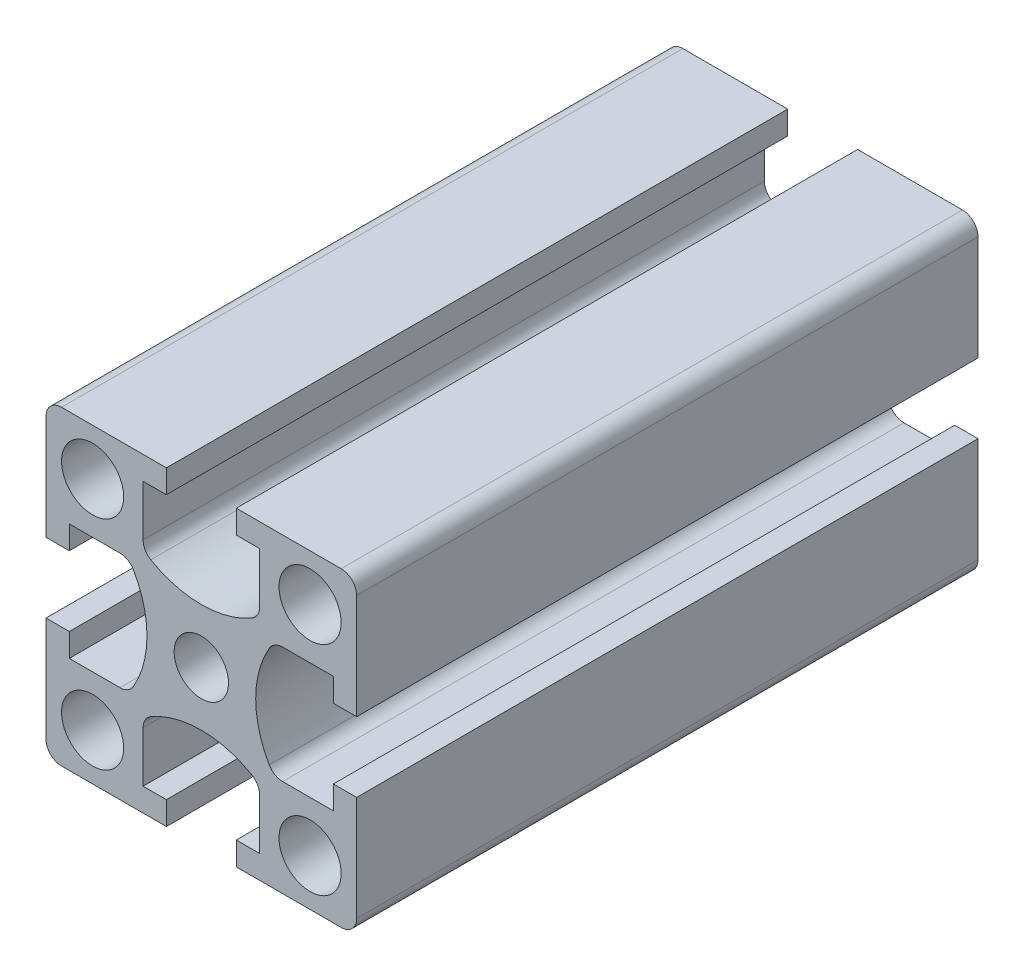
from build123d import *

# Parameters (mm, degrees)
SKETCH1_R           = 5
SKETCH1_R_2         = 4.375
BOSS_EXTRUDE1_DEPTH = 100


with BuildPart() as part:
    # Sketch1 → Boss-Extrude1 (new body)
    with BuildSketch(Plane.XY):
        with BuildLine():
            Line((-25, 22.5), (-25, 5.625))
            Line((-25, 5.625), (-21.25, 5.625))
            Line((-21.25, 5.625), (-21.25, 9.375))
            Line((-21.25, 9.375), (-13.092150698, 9.375))
            ThreePointArc((-13.092150698, 9.375), (-11.842150698, 9.040063509), (-10.927087189, 8.125))
            ThreePointArc((-10.927087189, 8.125), (-8.75, 0), (-10.927087189, -8.125))
            ThreePointArc((-10.927087189, -8.125), (-11.842150698, -9.040063509), (-13.092150698, -9.375))
            Line((-13.092150698, -9.375), (-21.25, -9.375))
            Line((-21.25, -9.375), (-21.25, -5.625))
            Line((-21.25, -5.625), (-25, -5.625))
            Line((-25, -5.625), (-25, -22.5))
            ThreePointArc((-25, -22.5), (-24.267766953, -24.267766953), (-22.5, -25))
            Line((-22.5, -25), (-5.625, -25))
            Line((-5.625, -25), (-5.625, -21.25))
            Line((-5.625, -21.25), (-9.375, -21.25))
            Line((-9.375, -21.25), (-9.375, -13.092150698))
            ThreePointArc((-9.375, -13.092150698), (-9.040063509, -11.842150698), (-8.125, -10.927087189))
            ThreePointArc((-8.125, -10.927087189), (0, -8.75), (8.125, -10.927087189))
            ThreePointArc((8.125, -10.927087189), (9.040063509, -11.842150698), (9.375, -13.092150698))
            Line((9.375, -13.092150698), (9.375, -21.25))
            Line((9.375, -21.25), (5.625, -21.25))
            Line((5.625, -21.25), (5.625, -25))
            Line((5.625, -25), (22.5, -25))
            ThreePointArc((22.5, -25), (24.267766953, -24.267766953), (25, -22.5))
            Line((25, -22.5), (25, -5.625))
            Line((25, -5.625), (21.25, -5.625))
            Line((21.25, -5.625), (21.25, -9.375))
            Line((21.25, -9.375), (13.092150698, -9.375))
            ThreePointArc((13.092150698, -9.375), (11.842150698, -9.040063509), (10.927087189, -8.125))
            ThreePointArc((10.927087189, -8.125), (8.75, 0), (10.927087189, 8.125))
            ThreePointArc((10.927087189, 8.125), (11.842150698, 9.040063509), (13.092150698, 9.375))
            Line((13.092150698, 9.375), (21.25, 9.375))
            Line((21.25, 9.375), (21.25, 5.625))
            Line((21.25, 5.625), (25, 5.625))
            Line((25, 5.625), (25, 22.5))
            ThreePointArc((25, 22.5), (24.267766953, 24.267766953), (22.5, 25))
            Line((22.5, 25), (5.625, 25))
            Line((5.625, 25), (5.625, 21.25))
            Line((5.625, 21.25), (9.375, 21.25))
            Line((9.375, 21.25), (9.375, 13.092150698))
            ThreePointArc((9.375, 13.092150698), (9.040063509, 11.842150698), (8.125, 10.927087189))
            ThreePointArc((8.125, 10.927087189), (0, 8.75), (-8.125, 10.927087189))
            ThreePointArc((-8.125, 10.927087189), (-9.040063509, 11.842150698), (-9.375, 13.092150698))
            Line((-9.375, 13.092150698), (-9.375, 21.25))
            Line((-9.375, 21.25), (-5.625, 21.25))
            Line((-5.625, 21.25), (-5.625, 25))
            Line((-5.625, 25), (-22.5, 25))
            ThreePointArc((-22.5, 25), (-24.267766953, 24.267766953), (-25, 22.5))
        make_face()
        with Locations((-17.5, -17.5)):
            Circle(SKETCH1_R, mode=Mode.SUBTRACT)
        with Locations((17.5, -17.5)):
            Circle(SKETCH1_R, mode=Mode.SUBTRACT)
        with Locations((17.5, 17.5)):
            Circle(SKETCH1_R, mode=Mode.SUBTRACT)
        Circle(SKETCH1_R_2, mode=Mode.SUBTRACT)
        with Locations((-17.5, 17.5)):
            Circle(SKETCH1_R, mode=Mode.SUBTRACT)
    extrude(amount=BOSS_EXTRUDE1_DEPTH)


solid = part.part
